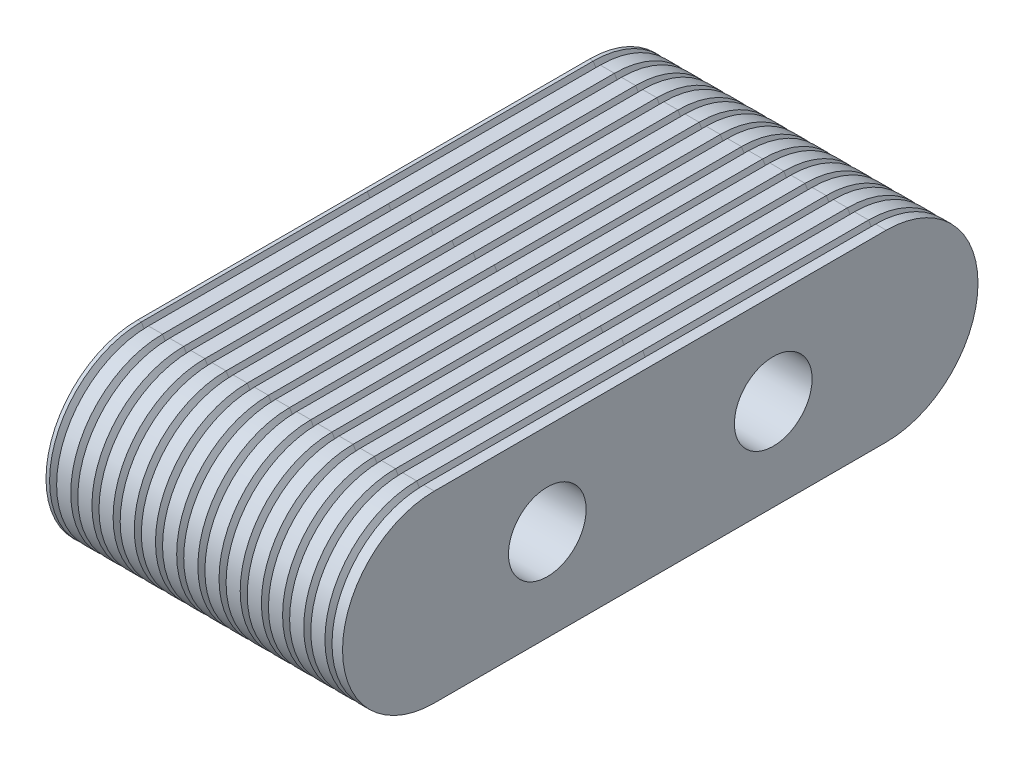
from build123d import *

# Parameters (mm, degrees)
BOSS_EXTRUDE1_DEPTH     = 10.5
LPATTERN1_COUNT         = 14
LPATTERN1_PITCH         = 1.5
CUT_EXTRUDE1_DEPTH      = 32.45631892
CUT_EXTRUDE1_DEPTH_BACK = 32.45631892
SKETCH5_R               = 2.75


with BuildPart() as part:
    # Sketch2 → Boss-Extrude1 (new, symmetric)
    with BuildSketch(Plane(origin=(0, 0, 0), x_dir=(0, 0, -1), z_dir=(1, 0, 0))):
        with BuildLine():
            Line((16, -6.5), (-16, -6.5))
            ThreePointArc((-16, -6.5), (-22.5, 0), (-16, 6.5))
            Line((-16, 6.5), (16, 6.5))
            ThreePointArc((16, 6.5), (22.5, 0), (16, -6.5))
        make_face()
    extrude(amount=BOSS_EXTRUDE1_DEPTH, both=True)

    # Cut-Sweep1: sweep along a path in Sketch4
    with BuildLine(Plane.ZY.offset(10.5)) as cut_sweep1_path:
        Line((-16, -6.5), (16, -6.5))
        ThreePointArc((16, -6.5), (22.5, 0), (16, 6.5))
        Line((16, 6.5), (-16, 6.5))
        ThreePointArc((-16, 6.5), (-22.5, 0), (-16, -6.5))
    # Sketch3 → Cut-Sweep1 (sweep, cut)
    with BuildSketch(Plane.XY):
        Polygon((-10.247493318, 6.5), (-9.997493318, 6.066987298), (-9.747493318, 6.5), align=None)
    cut_sweep1 = sweep(path=cut_sweep1_path.line, mode=Mode.SUBTRACT)

    # LPattern1: Cut-Sweep1 ×14
    with Locations(*[(i * LPATTERN1_PITCH, 0, 0) for i in range(1, LPATTERN1_COUNT)]):
        add(cut_sweep1, mode=Mode.SUBTRACT)

    # Sketch5 → Cut-Extrude1 (cut, two sides: drawn at the far end of the back side and taken through both)
    with BuildSketch(Plane(origin=(10.5, 0, 0), x_dir=(0, 0, -1), z_dir=(1, 0, 0)).offset(-CUT_EXTRUDE1_DEPTH_BACK)):
        with Locations((-8, 0)):
            Circle(SKETCH5_R)
        with Locations((8, 0)):
            Circle(SKETCH5_R)
    extrude(amount=CUT_EXTRUDE1_DEPTH + CUT_EXTRUDE1_DEPTH_BACK, mode=Mode.SUBTRACT)


solid = part.part
